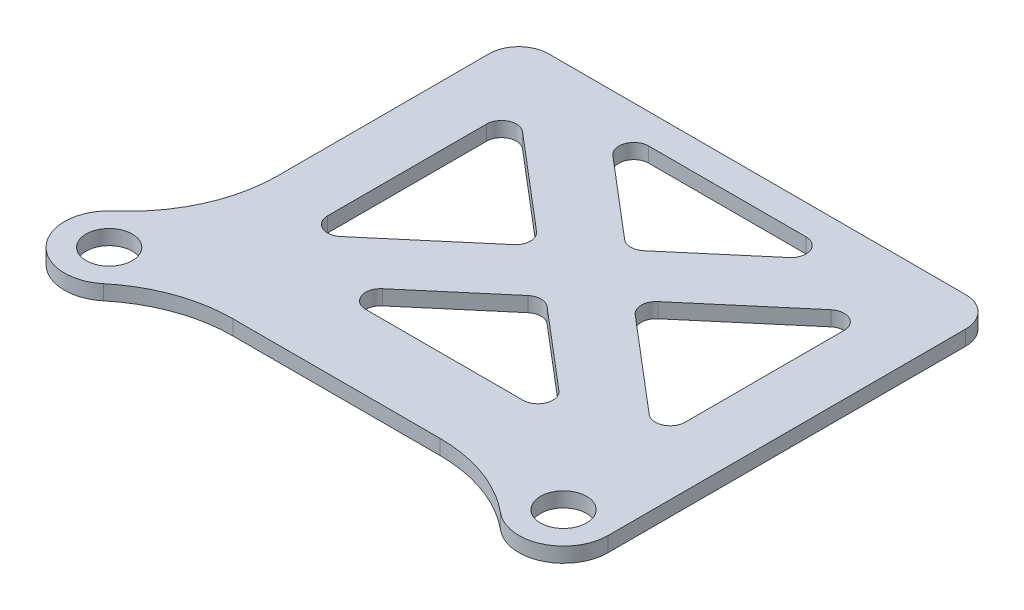
from build123d import *

# Parameters (mm, degrees)
SKETCH2_R           = 1.55
BOSS_EXTRUDE1_DEPTH = 1
FILLET1_R           = 10
FILLET2_R           = 2
FILLET3_R           = 1


with BuildPart() as part:
    # Sketch2 → Boss-Extrude1 (new body)
    # profile 1 of 2: a face of its own
    with BuildSketch(Plane(origin=(0, 0, 0), x_dir=(1, 0, 0), z_dir=(0, 1, 0))):
        with BuildLine():
            Line((-13.75, 26), (-13.75, 3))
            Line((-13.75, 3), (15.25, 3))
            ThreePointArc((15.25, 3), (17.371320344, 2.121320344), (18.25, 0))
            Line((18.25, 0), (18.25, 26))
            Line((18.25, 26), (-13.75, 26))
        make_face()
        Polygon((2.25, 11.8), (10.25, 5), (-5.75, 5), align=None, mode=Mode.SUBTRACT)
        Polygon((-9.75, 7), (-9.75, 22), (-0.926470588, 14.5), align=None, mode=Mode.SUBTRACT)
        Polygon((5.426470588, 14.5), (14.25, 22), (14.25, 7), align=None, mode=Mode.SUBTRACT)
        Polygon((-5.75, 24), (10.25, 24), (2.25, 17.2), align=None, mode=Mode.SUBTRACT)
    # profile 2 of 2: a face of its own
    with BuildSketch(Plane(origin=(0, 0, 0), x_dir=(1, 0, 0), z_dir=(0, 1, 0))):
        with BuildLine():
            ThreePointArc((15.25, -3), (13.128679656, -2.121320344), (12.25, 0))
            Line((12.25, 0), (-12.25, 0))
            ThreePointArc((-12.25, 0), (-13.128679656, -2.121320344), (-15.25, -3))
            ThreePointArc((-15.25, -3), (-18.25, 0), (-15.25, 3))
            Line((-15.25, 3), (15.25, 3))
            ThreePointArc((15.25, 3), (18.25, 0), (15.25, -3))
        make_face()
        with Locations(Location((15.25, 0, 0), (0, 0, 270))):
            Circle(SKETCH2_R, mode=Mode.SUBTRACT)
        with Locations(Location((-15.25, 0, 0), (0, 0, 270))):
            Circle(SKETCH2_R, mode=Mode.SUBTRACT)
    extrude(amount=BOSS_EXTRUDE1_DEPTH)

    # Fillet1
    fillet1_edges = [part.edges().sort_by_distance(p)[0] for p in [
        (-13.75, 0.5, -3),
        (12.25, 0.5, 0),
        (-12.25, 0.5, 0),
    ]]
    fillet(fillet1_edges, radius=FILLET1_R)

    # Fillet2
    fillet2_edges = [part.edges().sort_by_distance(p)[0] for p in [
        (-13.75, 0.5, -26),
        (18.25, 0.5, -26),
    ]]
    fillet(fillet2_edges, radius=FILLET2_R)

    # Fillet3
    fillet3_edges = [part.edges().sort_by_distance(p)[0] for p in [
        (-5.75, 0.5, -5),
        (10.25, 0.5, -5),
        (2.25, 0.5, -11.8),
        (-9.75, 0.5, -22),
        (-9.75, 0.5, -7),
        (-0.926470588, 0.5, -14.5),
        (14.25, 0.5, -22),
        (5.426470588, 0.5, -14.5),
        (14.25, 0.5, -7),
        (10.25, 0.5, -24),
        (-5.75, 0.5, -24),
        (2.25, 0.5, -17.2),
    ]]
    fillet(fillet3_edges, radius=FILLET3_R)


solid = part.part
